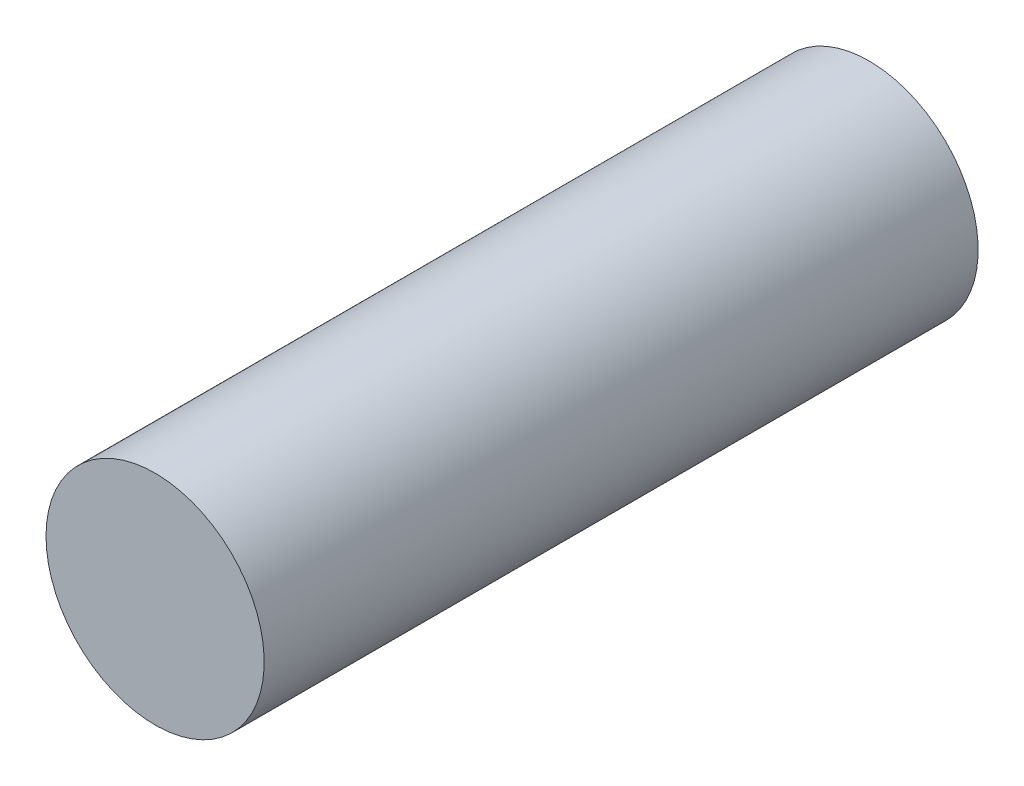
from build123d import *

# Parameters (mm, degrees)
SKETCH1_R           = 27.5
BOSS_EXTRUDE1_DEPTH = 180
SKETCH2_R           = 27.5
BOSS_EXTRUDE2_DEPTH = 180
SKETCH3_R           = 27.5
BOSS_EXTRUDE3_DEPTH = 180


with BuildPart() as part:
    # Sketch1 → Boss-Extrude1 (new body)
    with BuildSketch(Plane.XY):
        Circle(SKETCH1_R)
    extrude(amount=BOSS_EXTRUDE1_DEPTH)

    # Sketch2 → Boss-Extrude2 (add)
    with BuildSketch(Plane.XY):
        Circle(SKETCH2_R)
    extrude(amount=BOSS_EXTRUDE2_DEPTH)

    # Sketch3 → Boss-Extrude3 (add)
    with BuildSketch(Plane.XY):
        Circle(SKETCH3_R)
    extrude(amount=BOSS_EXTRUDE3_DEPTH)


solid = part.part
